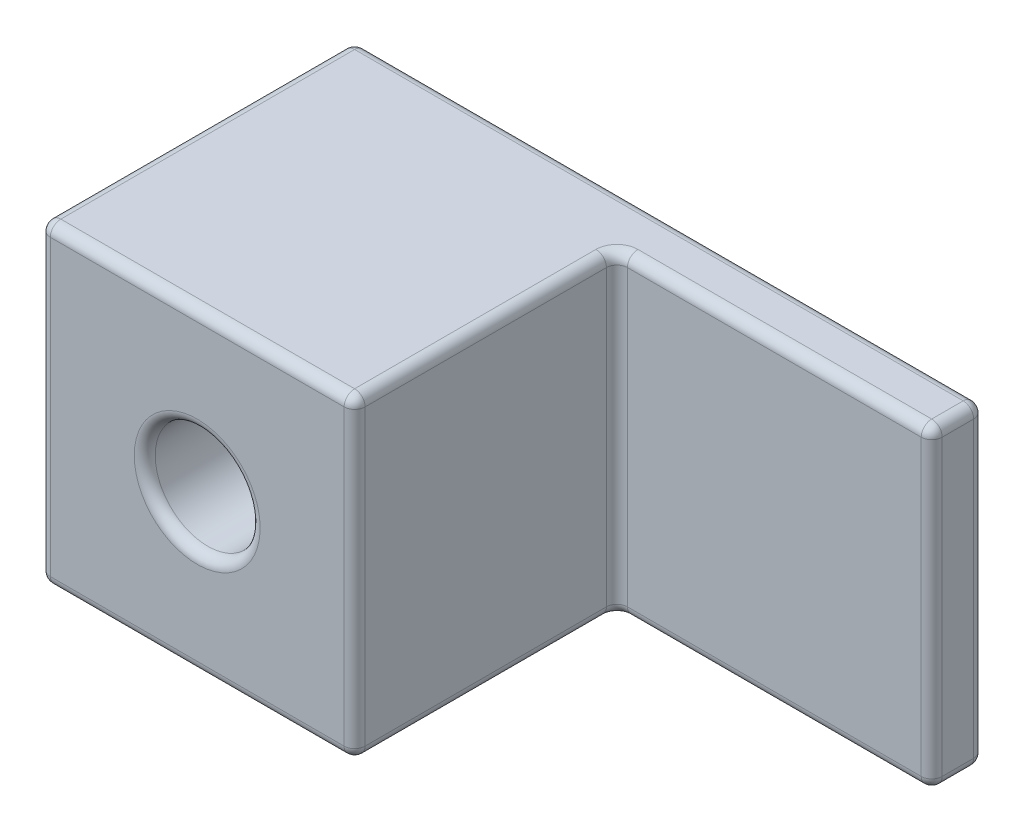
from build123d import *

# Parameters (mm, degrees)
SKETCH1_W           = 60
SKETCH1_H           = 60
SKETCH1_R           = 10
BOSS_EXTRUDE1_DEPTH = 60
SKETCH2_W           = 10
SKETCH2_H           = 60
BOSS_EXTRUDE2_DEPTH = 60
FILLET1_R           = 2


with BuildPart() as part:
    # Sketch1 → Boss-Extrude1 (new body)
    with BuildSketch(Plane.XY):
        with Locations((30, 30)):
            Rectangle(SKETCH1_W, SKETCH1_H)
        with Locations((30, 30)):
            Circle(SKETCH1_R, mode=Mode.SUBTRACT)
    extrude(amount=BOSS_EXTRUDE1_DEPTH)

    # Sketch2 → Boss-Extrude2 (add)
    with BuildSketch(Plane(origin=(60, 0, 0), x_dir=(0, 0, -1), z_dir=(1, 0, 0))):
        with Locations((-5, 30)):
            Rectangle(SKETCH2_W, SKETCH2_H)
    extrude(amount=BOSS_EXTRUDE2_DEPTH)

    # Fillet1
    fillet1_edges = [part.edges().sort_by_distance(p)[0] for p in [
        (20, 30, 0),
        (20, 30, 60),
        (60, 30, 60),
        (30, 60, 60),
        (60, 30, 10),
        (90, 60, 10),
        (90, 0, 10),
        (120, 30, 0),
        (120, 60, 5),
        (120, 30, 10),
        (120, 0, 5),
        (0, 30, 60),
        (60, 60, 0),
        (60, 0, 0),
        (0, 30, 0),
        (0, 60, 30),
        (60, 60, 35),
        (60, 0, 35),
        (0, 0, 30),
        (30, 0, 60),
    ]]
    fillet(fillet1_edges, radius=FILLET1_R)


solid = part.part
